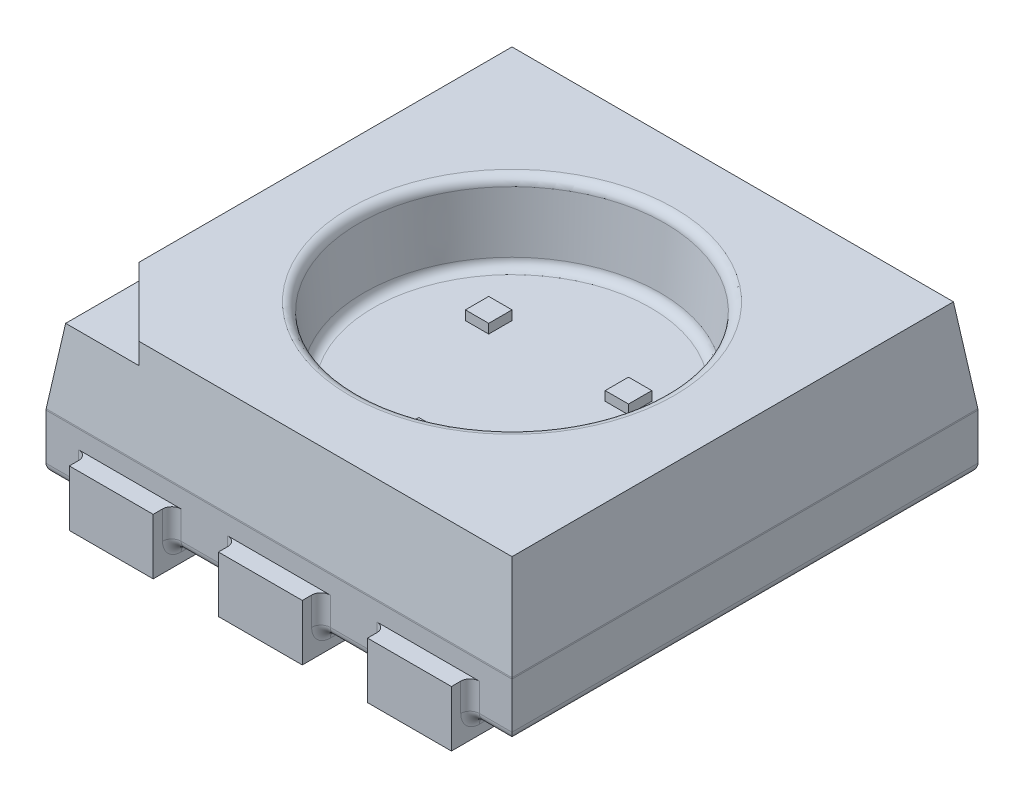
from build123d import *
from OCP.BRepFilletAPI import BRepFilletAPI_MakeChamfer

# Parameters (mm, degrees)
SKETCH1_W                = 5
SKETCH1_H                = 5
BOSS_EXTRUDE1_DEPTH      = 0.8
BOSS_EXTRUDE2_DEPTH      = 0.2
BOSS_EXTRUDE2_DEPTH_BACK = 0.4
SKETCH2_W                = 0.9
SKETCH2_H                = 1
CHAMFER1_SIZE            = 1
CHAMFER1_SIZE2           = 0.131652498
CUT_EXTRUDE1_DEPTH       = 0.2
SKETCH4_R                = 1.65
CUT_EXTRUDE2_DEPTH       = 0.8
CUT_EXTRUDE2_DRAFT       = -5
FILLET1_R                = 0.1
SKETCH5_W                = 0.25
SKETCH5_H                = 0.25
BOSS_EXTRUDE4_DEPTH      = 0.1
BOSS_EXTRUDE4_2_DEPTH    = 0.1
BOSS_EXTRUDE4_3_DEPTH    = 0.1


with BuildPart() as part:
    # Sketch1 → Boss-Extrude1 (new, symmetric)
    with BuildSketch(Plane(origin=(0, 0, 0), x_dir=(1, 0, 0), z_dir=(0, 1, 0))):
        Rectangle(SKETCH1_W, SKETCH1_H)
    extrude(amount=BOSS_EXTRUDE1_DEPTH, both=True)

    # Sketch2 → Boss-Extrude2 (add, two sides: drawn at the far end of the back side and taken through both)
    with BuildSketch(Plane.XZ.offset(0.8).offset(-BOSS_EXTRUDE2_DEPTH_BACK)):
        with Locations((-1.6, 2.2)):
            Rectangle(SKETCH2_W, SKETCH2_H)
        with Locations((1.6, 2.2)):
            Rectangle(SKETCH2_W, SKETCH2_H)
        with Locations((0, 2.2)):
            Rectangle(SKETCH2_W, SKETCH2_H)
        with Locations((1.6, -2.2)):
            Rectangle(SKETCH2_W, SKETCH2_H)
        with Locations((0, -2.2)):
            Rectangle(SKETCH2_W, SKETCH2_H)
        with Locations((-1.6, -2.2)):
            Rectangle(SKETCH2_W, SKETCH2_H)
    extrude(amount=BOSS_EXTRUDE2_DEPTH + BOSS_EXTRUDE2_DEPTH_BACK)

    # Chamfer1: one chamfer whose edges measure the first distance from different faces: ONE call of the kernel's chamfer builder (chamfer() names one face for all edges)
    chamfer1_edges_1 = [part.edges().sort_by_distance(p)[0] for p in [
        (-2.5, 0.8, 0),
    ]]
    chamfer1_side_1 = [part.faces().sort_by_distance(p)[0] for p in [
        (-2.5, 0, 0),
    ]]
    chamfer1_edges_2 = [part.edges().sort_by_distance(p)[0] for p in [
        (0, 0.8, 2.5),
    ]]
    chamfer1_side_2 = [part.faces().sort_by_distance(p)[0] for p in [
        (0, 0.093641618, 2.5),
    ]]
    chamfer1_edges_3 = [part.edges().sort_by_distance(p)[0] for p in [
        (2.5, 0.8, 0),
    ]]
    chamfer1_side_3 = [part.faces().sort_by_distance(p)[0] for p in [
        (2.5, 0, 0),
    ]]
    chamfer1_edges_4 = [part.edges().sort_by_distance(p)[0] for p in [
        (0, 0.8, -2.5),
    ]]
    chamfer1_side_4 = [part.faces().sort_by_distance(p)[0] for p in [
        (0, 0.093641618, -2.5),
    ]]
    chamfer1 = BRepFilletAPI_MakeChamfer(part.part.solid().wrapped)
    for e in chamfer1_edges_1:
        chamfer1.Add(CHAMFER1_SIZE, CHAMFER1_SIZE2, e.wrapped, chamfer1_side_1[0].wrapped)  # the first distance lies on this face
    for e in chamfer1_edges_2:
        chamfer1.Add(CHAMFER1_SIZE, CHAMFER1_SIZE2, e.wrapped, chamfer1_side_2[0].wrapped)  # the first distance lies on this face
    for e in chamfer1_edges_3:
        chamfer1.Add(CHAMFER1_SIZE, CHAMFER1_SIZE2, e.wrapped, chamfer1_side_3[0].wrapped)  # the first distance lies on this face
    for e in chamfer1_edges_4:
        chamfer1.Add(CHAMFER1_SIZE, CHAMFER1_SIZE2, e.wrapped, chamfer1_side_4[0].wrapped)  # the first distance lies on this face
    add(Compound.cast(chamfer1.Shape()), mode=Mode.REPLACE)

    # Sketch3 → Cut-Extrude1 (cut)
    with BuildSketch(Plane(origin=(0, 0.8, 0), x_dir=(1, 0, 0), z_dir=(0, 1, 0))):
        Polygon((-2.5, -1.5), (-1.5, -2.5), (-2.5, -2.5), align=None)
    extrude(amount=-CUT_EXTRUDE1_DEPTH, mode=Mode.SUBTRACT)


with BuildPart() as cut_extrude2_tool:
    # Sketch4 → Cut-Extrude2 (with draft: the straight prism first)
    with BuildSketch(Plane(origin=(0, 0.8, 0), x_dir=(1, 0, 0), z_dir=(0, 1, 0))):
        Circle(SKETCH4_R)
    extrude(amount=-CUT_EXTRUDE2_DEPTH)
    # Cut-Extrude2: the draft: its side faces are tilted about the plane it starts from
    cut_extrude2_sides = [cut_extrude2_tool.faces().sort_by_distance(p)[0] for p in [
        (-1.65, 0.4, 0),
    ]]
    draft(cut_extrude2_sides, Plane(origin=(0, 0.8, 0), x_dir=(1, 0, 0), z_dir=(0, 1, 0)), CUT_EXTRUDE2_DRAFT)


with BuildPart() as part_1:
    add(part.part)

    # Cut-Extrude2: cut by cut_extrude2_tool
    add(cut_extrude2_tool.part, mode=Mode.SUBTRACT)

    # Fillet1
    fillet1_edges = [part_1.edges().sort_by_distance(p)[0] for p in [
        (-2.05, -0.6, -2.5),
        (-1.15, -0.6, -2.5),
        (0, -0.2, 2.5),
        (-2.5, -0.2, 0),
        (0, -0.2, -2.5),
        (2.5, -0.2, 0),
        (-0.8, -0.8, 2.5),
        (-2.05, -0.8, 2.1),
        (-1.6, -0.8, 1.7),
        (-1.580009069, 0, 0),
        (-1.65, 0.8, 0),
        (-1.15, -0.8, 2.1),
        (-1.15, -0.6, 2.5),
        (-2.05, -0.6, 2.5),
        (0.8, -0.8, 2.5),
        (-0.45, -0.8, 2.1),
        (0, -0.8, 1.7),
        (0.45, -0.8, 2.1),
        (0.45, -0.6, 2.5),
        (-0.45, -0.6, 2.5),
        (2.275, -0.8, 2.5),
        (1.15, -0.8, 2.1),
        (1.6, -0.8, 1.7),
        (2.05, -0.8, 2.1),
        (-2.275, -0.8, 2.5),
        (2.05, -0.6, 2.5),
        (1.15, -0.6, 2.5),
        (-2.5, -0.8, 0),
        (2.275, -0.8, -2.5),
        (2.5, -0.8, 0),
        (0.8, -0.8, -2.5),
        (2.05, -0.8, -2.1),
        (1.6, -0.8, -1.7),
        (1.15, -0.8, -2.1),
        (1.15, -0.6, -2.5),
        (2.05, -0.6, -2.5),
        (-0.8, -0.8, -2.5),
        (0.45, -0.8, -2.1),
        (0, -0.8, -1.7),
        (-0.45, -0.8, -2.1),
        (-0.45, -0.6, -2.5),
        (0.45, -0.6, -2.5),
        (-2.275, -0.8, -2.5),
        (-1.15, -0.8, -2.1),
        (-1.6, -0.8, -1.7),
        (-2.05, -0.8, -2.1),
    ]]
    fillet(fillet1_edges, radius=FILLET1_R)


with BuildPart() as body_2:
    # Sketch5 → Boss-Extrude4 (new body)
    with BuildSketch(Plane(origin=(0, 0, 0), x_dir=(1, 0, 0), z_dir=(0, 1, 0))):
        with Locations((-0.75, 0.5)):
            Rectangle(SKETCH5_W, SKETCH5_H)
    extrude(amount=BOSS_EXTRUDE4_DEPTH)


with BuildPart() as body_3:
    # Sketch5 → Boss-Extrude4 2 (new body)
    with BuildSketch(Plane(origin=(0, 0, 0), x_dir=(1, 0, 0), z_dir=(0, 1, 0))):
        with Locations((0, -1)):
            Rectangle(SKETCH5_W, SKETCH5_H)
    extrude(amount=BOSS_EXTRUDE4_2_DEPTH)


with BuildPart() as body_4:
    # Sketch5 → Boss-Extrude4 3 (new body)
    with BuildSketch(Plane(origin=(0, 0, 0), x_dir=(1, 0, 0), z_dir=(0, 1, 0))):
        with Locations((0.75, 0.5)):
            Rectangle(SKETCH5_W, SKETCH5_H)
    extrude(amount=BOSS_EXTRUDE4_3_DEPTH)


solid = Compound([part_1.part, body_2.part, body_3.part, body_4.part])
